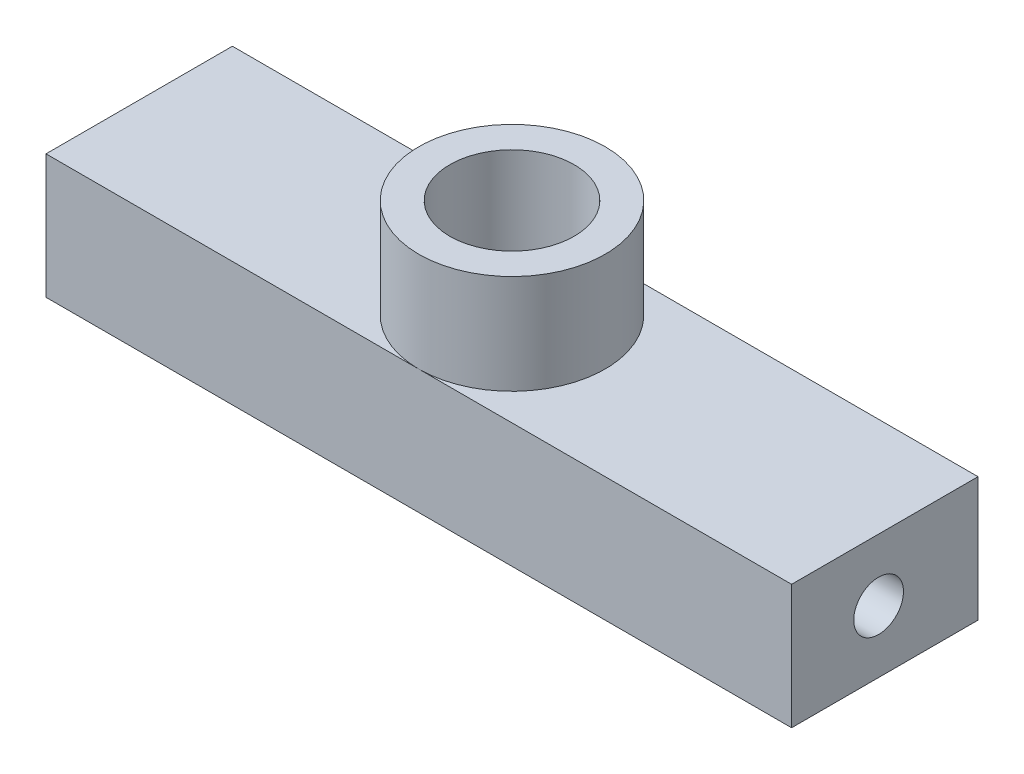
from build123d import *

# Parameters (mm, degrees)
SKETCH1_W           = 30
SKETCH1_H           = 7.5
BOSS_EXTRUDE1_DEPTH = 5
SKETCH2_R           = 3.75
SKETCH2_R_2         = 2.5
BOSS_EXTRUDE2_DEPTH = 4
SKETCH3_R           = 1.75
CUT_EXTRUDE1_DEPTH  = 18.890290663
SKETCH4_R           = 2.5
CUT_EXTRUDE3_DEPTH  = 4
SKETCH5_R           = 1
CUT_EXTRUDE4_DEPTH  = 10
CUT_EXTRUDE5_START  = -10
SKETCH6_R           = 1
CUT_EXTRUDE5_DEPTH  = 10


with BuildPart() as part:
    # Sketch1 → Boss-Extrude1 (new body)
    with BuildSketch(Plane(origin=(0, 0, 0), x_dir=(1, 0, 0), z_dir=(0, 1, 0))):
        Rectangle(SKETCH1_W, SKETCH1_H)
    extrude(amount=BOSS_EXTRUDE1_DEPTH)

    # Sketch2 → Boss-Extrude2 (add)
    with BuildSketch(Plane(origin=(0, 5, 0), x_dir=(1, 0, 0), z_dir=(0, 1, 0))):
        with Locations(Location((0, 0, 0), (0, 0, 270))):
            Circle(SKETCH2_R)
        with Locations(Location((0, 0, 0), (0, 0, 270))):
            Circle(SKETCH2_R_2, mode=Mode.SUBTRACT)
    extrude(amount=BOSS_EXTRUDE2_DEPTH)

    # Sketch3 → Cut-Extrude1 (cut, through all)
    with BuildSketch(Plane.XZ):
        with Locations(Location((0, 0, 0), (0, 0, 270))):
            Circle(SKETCH3_R)
    extrude(amount=-CUT_EXTRUDE1_DEPTH, mode=Mode.SUBTRACT)

    # Sketch4 → Cut-Extrude3 (cut)
    with BuildSketch(Plane(origin=(0, 0, 0), x_dir=(-1, 0, 0), z_dir=(0, -1, 0))):
        with Locations(Location((0, 0, 0), (0, 0, 270))):
            Circle(SKETCH4_R)
    extrude(amount=-CUT_EXTRUDE3_DEPTH, mode=Mode.SUBTRACT)

    # Sketch5 → Cut-Extrude4 (cut)
    with BuildSketch(Plane(origin=(15, 0, 0), x_dir=(0, 0, -1), z_dir=(1, 0, 0))):
        with Locations((-0.25, 2.5)):
            Circle(SKETCH5_R)
    extrude(amount=-CUT_EXTRUDE4_DEPTH, mode=Mode.SUBTRACT)

    # Sketch6 → Cut-Extrude5 (cut)
    with BuildSketch(Plane.ZY.offset(15).offset(CUT_EXTRUDE5_START)):
        with Locations(Location((0.25, 2.5, 0), (0, 0, 180))):
            Circle(SKETCH6_R)
    extrude(amount=CUT_EXTRUDE5_DEPTH, mode=Mode.SUBTRACT)


solid = part.part
